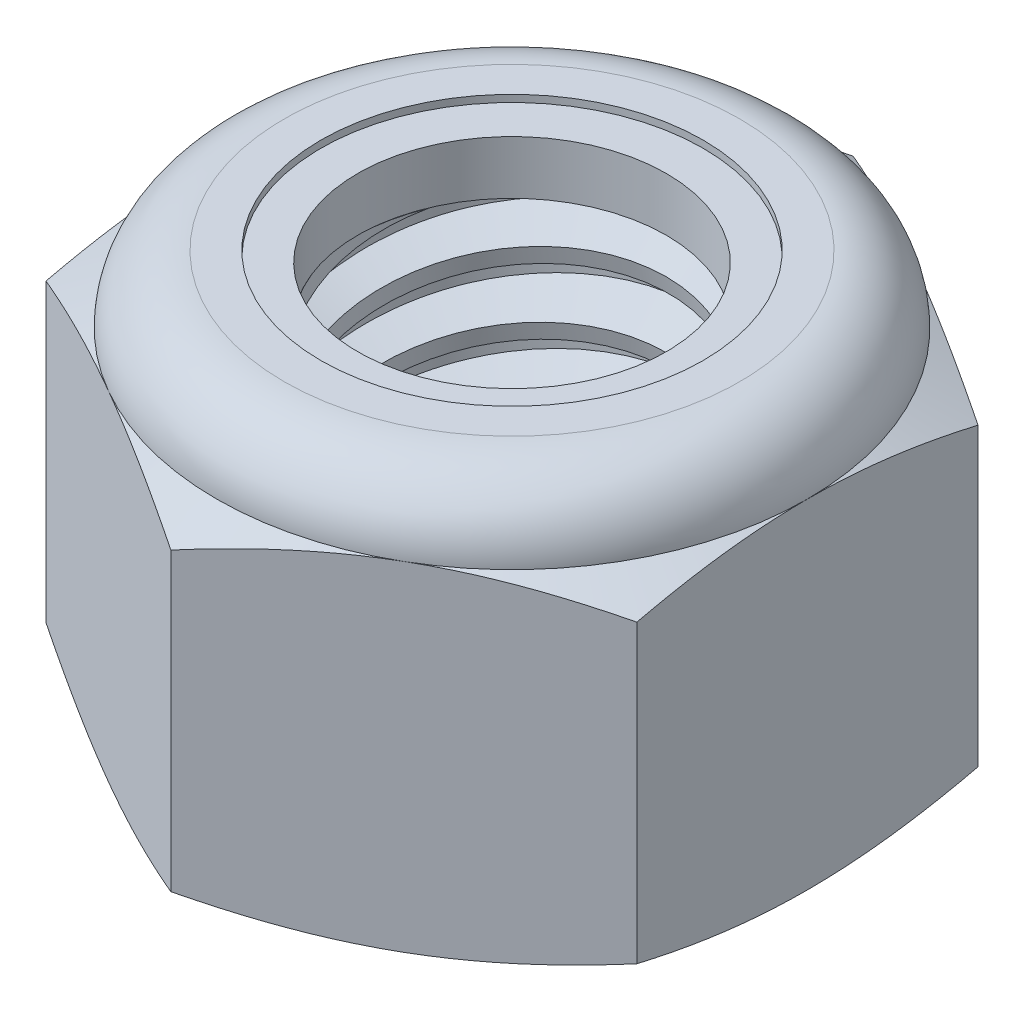
from build123d import *

# Parameters (mm, degrees)
EXTRUDE1_DEPTH      = 8.73125
SKETCH2_W           = 3.9624
SKETCH2_H           = 8.73125
LPATTERN1_COUNT     = 6
LPATTERN1_PITCH     = 1.411111111
LPATTERN1_COL_COUNT = 2
LPATTERN1_COL_PITCH = 1.411111111


with BuildPart() as part:
    # Sketch1 → Extrude1 (new body)
    with BuildSketch(Plane(origin=(0, 0, 0), x_dir=(1, 0, 0), z_dir=(0, 1, 0))):
        Polygon((0, 7.332348419), (-6.35, 3.666174209), (-6.35, -3.666174209), (0, -7.332348419), (6.35, -3.666174209), (6.35, 3.666174209), align=None)
    extrude(amount=EXTRUDE1_DEPTH)

    # Sketch4 → Cut-Revolve2 (revolve, cut)
    with BuildSketch(Plane(origin=(0, 0, 0), x_dir=(0, 0, -1), z_dir=(1, 0, 0)), mode=Mode.PRIVATE) as cut_revolve2_sk:
        Polygon((0, 8.73125), (3.9624, 8.73125), (3.318668226, 8.431072944), (3.318668226, 0.300177056), (3.9624, 0), (0, 0), align=None)
    revolve(cut_revolve2_sk.sketch.rotate(Axis((0, 8.73125, 0), (0, 1, 0)), 54.613905467), axis=Axis((0, 8.73125, 0), (0, 1, 0)), mode=Mode.SUBTRACT)


with BuildPart() as body_2:
    # Sketch2 → Revolve1 (revolve)
    with BuildSketch(Plane(origin=(0, 0, 0), x_dir=(0, 0, -1), z_dir=(1, 0, 0))):
        with Locations((1.9812, 4.365625)):
            Rectangle(SKETCH2_W, SKETCH2_H)
    revolve(axis=Axis((0, -3.9624, 0), (0, 1, 0)))

    # Sketch3 → Cut-Revolve1 (revolve, cut)
    with BuildSketch(Plane(origin=(0, 0, 0), x_dir=(0, 0, -1), z_dir=(1, 0, 0)), mode=Mode.PRIVATE) as cut_revolve1_sk:
        Polygon((3.993321894, 8.557592646), (4.209775148, 7.341991167), (3.380512014, 7.642238826), (3.318668226, 7.989553534), align=None)
    cut_revolve1 = revolve(cut_revolve1_sk.sketch.rotate(Axis((0, 8.73125, 0.26919352), (0, -0.9845141333311523, -0.1753052231715019)), 180), axis=Axis((0, 8.73125, 0.26919352), (0, -0.9845141333311523, -0.1753052231715019)), mode=Mode.SUBTRACT)

    # LPattern1: Cut-Revolve1 ×6
    with Locations(*[(0, -i * LPATTERN1_PITCH, 0) for i in range(1, LPATTERN1_COUNT)]):
        add(cut_revolve1, mode=Mode.SUBTRACT)

    # LPattern1 col: Cut-Revolve1 ×2
    with Locations(*[(0, i * LPATTERN1_COL_PITCH, 0) for i in range(1, LPATTERN1_COL_COUNT)]):
        add(cut_revolve1, mode=Mode.SUBTRACT)


with BuildPart() as part_1:
    add(part.part)

    # Combine1: cut body 2
    add(body_2.part, mode=Mode.SUBTRACT)

    # Sketch5 → Cut-Revolve3 (revolve, cut)
    with BuildSketch(Plane(origin=(0, 0, 0), x_dir=(0, 0, -1), z_dir=(1, 0, 0)), mode=Mode.PRIVATE) as cut_revolve3_sk:
        with BuildLine():
            Line((0, 0), (6.35, 0))
            Line((6.35, 0), (7.332348419, 0.458076591))
            Line((7.332348419, 0.458076591), (7.332348419, 6.817965076))
            Line((7.332348419, 6.817965076), (6.35, 7.276041667))
            ThreePointArc((6.35, 7.276041667), (5.923779347, 8.305029347), (4.894791667, 8.73125))
            Line((4.894791667, 8.73125), (4.894791667, 10.00125))
            Line((4.894791667, 10.00125), (8.602348419, 10.00125))
            Line((8.602348419, 10.00125), (8.602348419, -1.27))
            Line((8.602348419, -1.27), (0, -1.27))
            Line((0, -1.27), (0, 0))
        make_face()
    revolve(cut_revolve3_sk.sketch.rotate(Axis((0, 0, 0), (0, 1, 0)), 54.613905467), axis=Axis((0, 0, 0), (0, 1, 0)), mode=Mode.SUBTRACT)

    # Sketch6 → Cut-Revolve4 (revolve, cut)
    with BuildSketch(Plane(origin=(0, 0, 0), x_dir=(0, 0, -1), z_dir=(1, 0, 0)), mode=Mode.PRIVATE) as cut_revolve4_sk:
        with BuildLine():
            Line((0, 7.276041667), (6.1976, 7.276041667))
            ThreePointArc((6.1976, 7.276041667), (5.816016274, 8.197266274), (4.894791667, 8.57885))
            Line((4.894791667, 8.57885), (4.106729947, 8.57885))
            Line((4.106729947, 8.57885), (4.106729947, 10.00125))
            Line((4.106729947, 10.00125), (0, 10.00125))
            Line((0, 10.00125), (0, 7.276041667))
        make_face()
    revolve(cut_revolve4_sk.sketch.rotate(Axis((0, 10.00125, 0), (0, 1, 0)), 54.613905467), axis=Axis((0, 10.00125, 0), (0, 1, 0)), mode=Mode.SUBTRACT)


with BuildPart() as body_2_2:
    # Sketch7 → Revolve2 (revolve)
    with BuildSketch(Plane(origin=(0, 0, 0), x_dir=(0, 0, -1), z_dir=(1, 0, 0))):
        with BuildLine():
            Line((3.318668226, 7.352241667), (6.119030844, 7.352241667))
            ThreePointArc((6.119030844, 7.352241667), (5.734762038, 8.169919611), (4.894791667, 8.50265))
            Line((4.894791667, 8.50265), (3.318668226, 8.50265))
            Line((3.318668226, 8.50265), (3.318668226, 7.352241667))
        make_face()
    revolve(axis=Axis((0, 7.352241667, 0), (0, 1, 0)))


solid = Compound([part_1.part, body_2_2.part])
